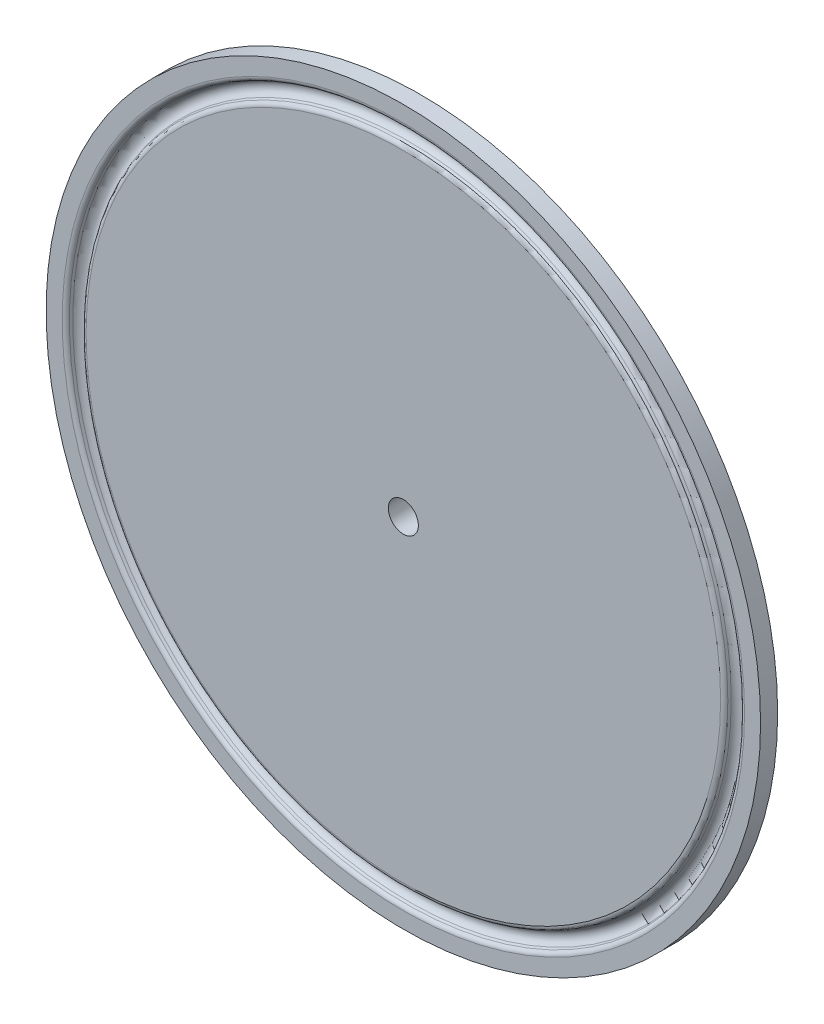
from build123d import *

# Parameters (mm, degrees)
SKETCH2_R               = 3.5
SKETCH2_R_2             = 2.5
BOSS_EXTRUDE1_DEPTH     = 10
CUT_EXTRUDE1_DEPTH      = 85.683624036
CUT_EXTRUDE1_DEPTH_BACK = 85.683624036
SKETCH3_R               = 2.5
FILLET1_R               = 2


with BuildPart() as part:
    # Sketch1 → Revolve1 (revolve)
    with BuildSketch(Plane(origin=(0, 0, 0), x_dir=(0, 0, -1), z_dir=(1, 0, 0)), mode=Mode.PRIVATE) as revolve1_sk:
        with BuildLine():
            Line((0, 0), (0, 52.809927725))
            ThreePointArc((0, 52.809927725), (0.130798304, 53.244522907), (0.479738309, 53.534733247))
            Line((0.479738309, 53.534733247), (0.872854821, 53.701601306))
            ThreePointArc((0.872854821, 53.701601306), (1.6002, 54.8005), (0.872854821, 55.899398694))
            Line((0.872854821, 55.899398694), (0.479738309, 56.066266753))
            ThreePointArc((0.479738309, 56.066266753), (0.130798304, 56.356477093), (0, 56.791072275))
            Line((0, 56.791072275), (0, 59.4614))
            Line((0, 59.4614), (2.8448, 59.4614))
            Line((2.8448, 59.4614), (7.9248, 45.504214709))
            Line((7.9248, 45.504214709), (7.9248, 0))
            Line((7.9248, 0), (0, 0))
        make_face()
    revolve(revolve1_sk.sketch.rotate(Axis((0, 0, 0), (0, 0, -1)), 90), axis=Axis((0, 0, 0), (0, 0, -1)))

    # Sketch2 → Boss-Extrude1 (add)
    with BuildSketch(Plane(origin=(0, 0, -7.9248), x_dir=(-1, 0, 0), z_dir=(0, 0, -1))):
        with Locations(Location((0, 0, 0), (0, 0, 180))):
            Circle(SKETCH2_R)
        Circle(SKETCH2_R_2, mode=Mode.SUBTRACT)
    extrude(amount=BOSS_EXTRUDE1_DEPTH)

    # Sketch3 → Cut-Extrude1 (cut, two sides: drawn at the far end of the back side and taken through both)
    with BuildSketch(Plane(origin=(0, 0, -7.9248), x_dir=(-1, 0, 0), z_dir=(0, 0, -1)).offset(-CUT_EXTRUDE1_DEPTH_BACK)):
        Circle(SKETCH3_R)
    extrude(amount=CUT_EXTRUDE1_DEPTH + CUT_EXTRUDE1_DEPTH_BACK, mode=Mode.SUBTRACT)

    # Fillet1
    fillet1_edges = [part.edges().sort_by_distance(p)[0] for p in [
        (-3.5, 0, -7.9248),
    ]]
    fillet(fillet1_edges, radius=FILLET1_R)


solid = part.part
